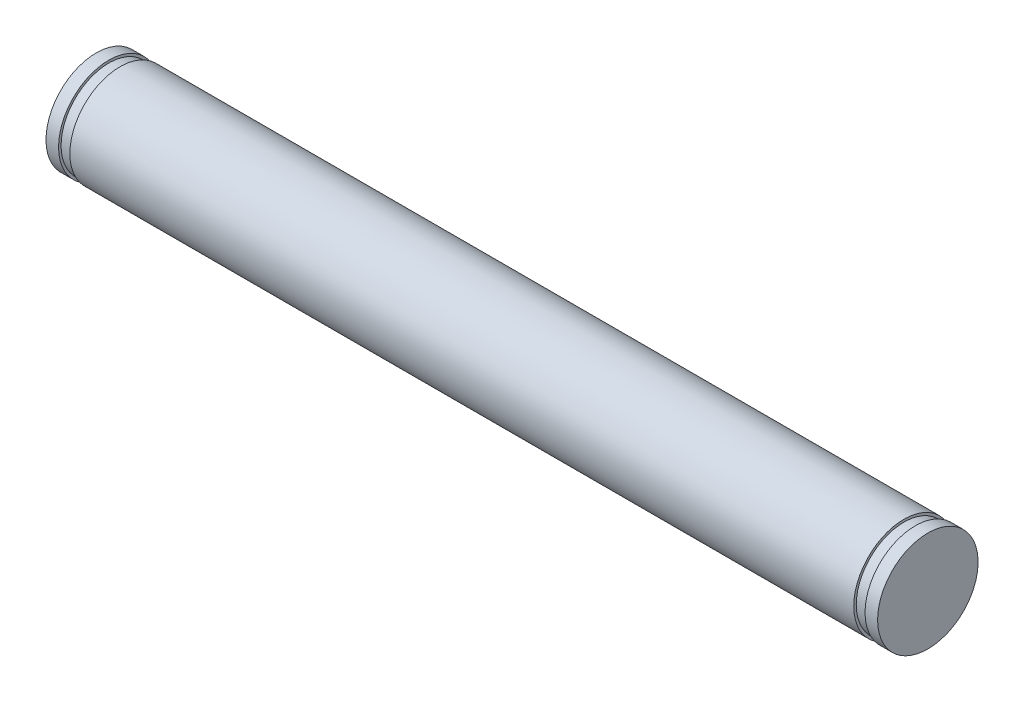
from build123d import *


with BuildPart() as part:
    # Sketch1 → Revolve1 (revolve)
    with BuildSketch(Plane.XY, mode=Mode.PRIVATE) as revolve1_sk:
        Polygon((-1.9, 4), (-1.9, 0), (0, 0), (62.4, 0), (64.3, 0), (64.3, 4), (63.3, 4), (63.3, 3.8), (62.4, 3.8), (62.4, 4), (0, 4), (0, 3.8), (-0.9, 3.8), (-0.9, 4), align=None)
        Polygon((62.4, 1.680571503), (62.4, 1.781506728), (62.123398622, 1.781506728), align=None, mode=Mode.SUBTRACT)
    revolve(revolve1_sk.sketch.rotate(Axis((0, 0, 0), (1, 0, 0)), 90), axis=Axis((0, 0, 0), (1, 0, 0)))


solid = part.part
